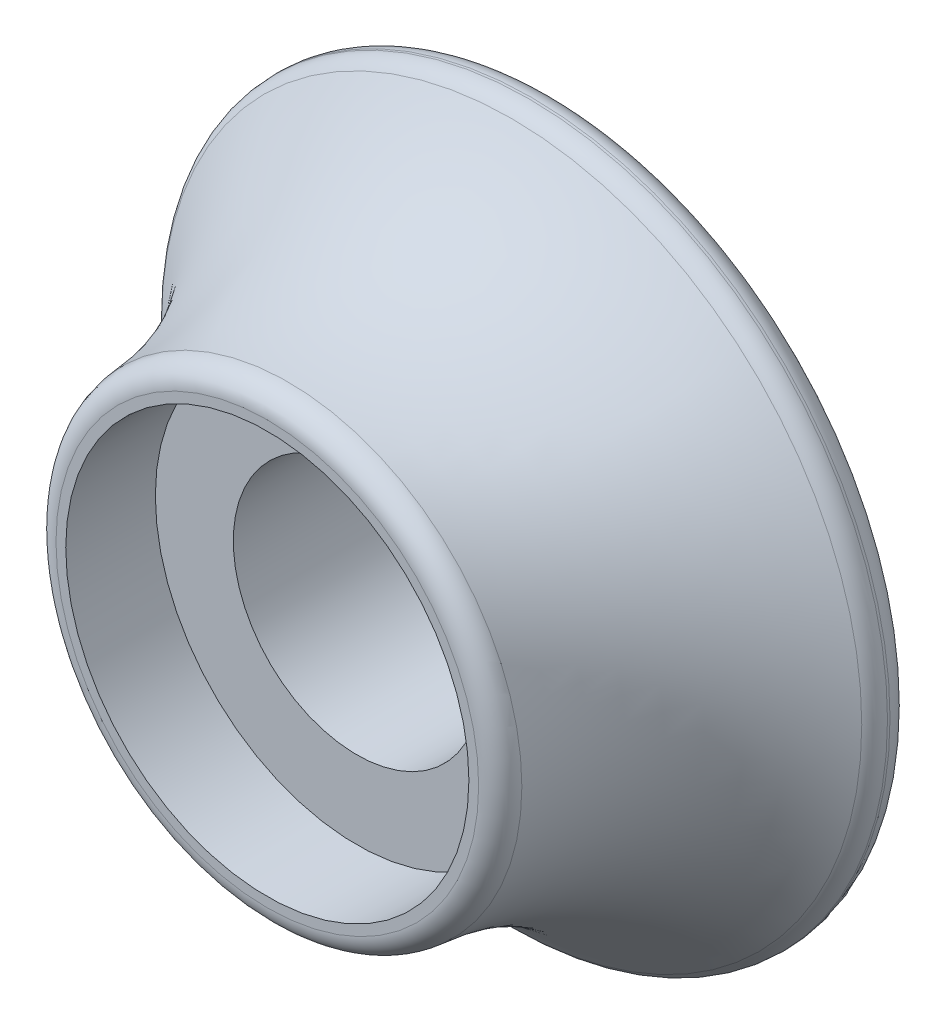
from build123d import *

# Parameters (mm, degrees)
SKETCH1_R           = 25.4
BOSS_EXTRUDE1_DEPTH = 20.32
SKETCH2_R           = 14.2875
CUT_EXTRUDE1_DEPTH  = 6.35
CUT_EXTRUDE2_START  = -17.78
SKETCH3_R           = 25.4
SKETCH3_R_2         = 16.51
CUT_EXTRUDE2_DEPTH  = 17.78
SKETCH6_R           = 8.763
CUT_EXTRUDE3_DEPTH  = 39.5419369
FILLET1_R           = 1.5875


with BuildPart() as part:
    # Sketch1 → Boss-Extrude1 (new body)
    with BuildSketch(Plane.XY):
        Circle(SKETCH1_R)
    extrude(amount=BOSS_EXTRUDE1_DEPTH)

    # Sketch2 → Cut-Extrude1 (cut)
    with BuildSketch(Plane.XY.offset(20.32)):
        Circle(SKETCH2_R)
    extrude(amount=-CUT_EXTRUDE1_DEPTH, mode=Mode.SUBTRACT)

    # Sketch3 → Cut-Extrude2 (cut)
    with BuildSketch(Plane.XY.offset(20.32).offset(CUT_EXTRUDE2_START)):
        Circle(SKETCH3_R)
        Circle(SKETCH3_R_2, mode=Mode.SUBTRACT)
    extrude(amount=CUT_EXTRUDE2_DEPTH, mode=Mode.SUBTRACT)

    # Sketch5 → Revolve1 (revolve)
    with BuildSketch(Plane(origin=(0, 0, 0), x_dir=(1, 0, 0), z_dir=(0, 1, 0)), mode=Mode.PRIVATE) as revolve1_sk:
        with BuildLine():
            Line((-25.4, -2.54), (-16.51, -2.54))
            Line((-16.51, -2.54), (-16.51, -20.32))
            ThreePointArc((-16.51, -20.32), (-18.869673356, -10.387336678), (-25.4, -2.54))
        make_face()
    revolve(revolve1_sk.sketch.rotate(Axis((0, 0, 0), (0, 0, -1)), 180), axis=Axis((0, 0, 0), (0, 0, -1)))

    # Sketch6 → Cut-Extrude3 (cut, through all)
    with BuildSketch(Plane.XY.offset(13.97)):
        Circle(SKETCH6_R)
    extrude(amount=-CUT_EXTRUDE3_DEPTH, mode=Mode.SUBTRACT)

    # Fillet1
    fillet1_edges = [part.edges().sort_by_distance(p)[0] for p in [
        (-25.4, 0, 2.54),
        (-16.51, 0, 20.32),
        (-25.4, 0, 0),
    ]]
    fillet(fillet1_edges, radius=FILLET1_R)


solid = part.part
